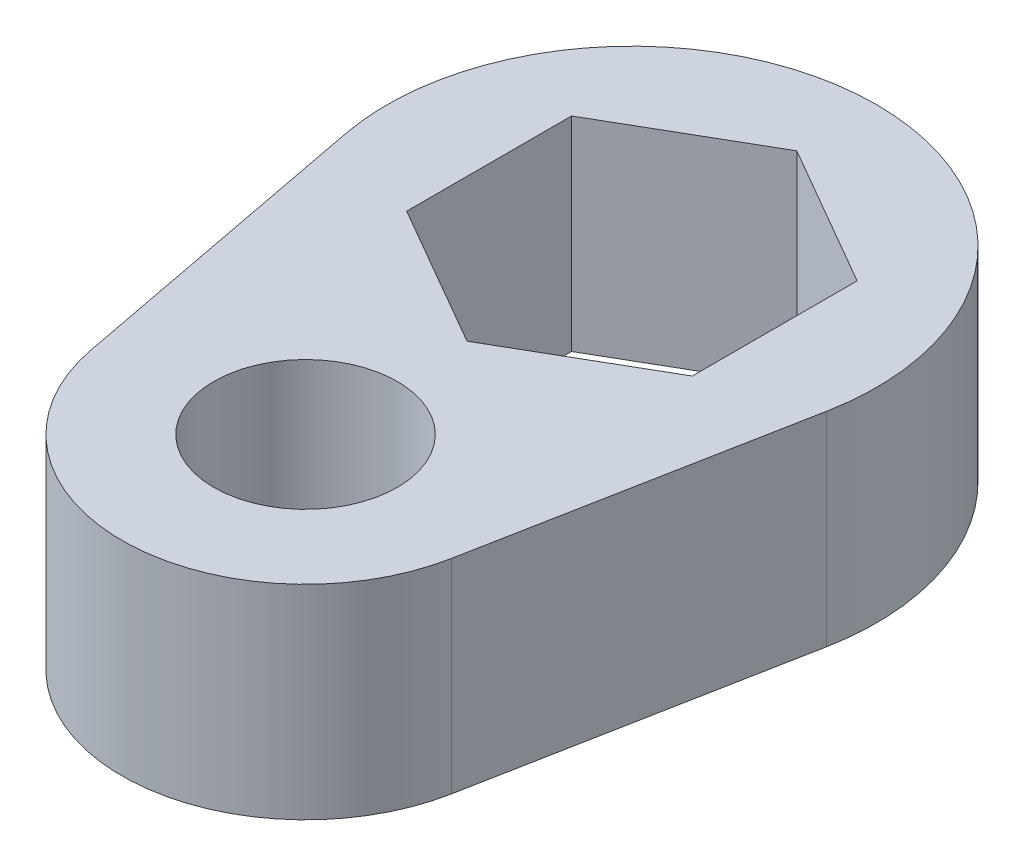
from build123d import *

# Parameters (mm, degrees)
SKETCH1_R           = 2.25
BOSS_EXTRUDE1_DEPTH = 5


with BuildPart() as part:
    # Sketch1 → Boss-Extrude1 (new body)
    with BuildSketch(Plane(origin=(0, 0, 0), x_dir=(1, 0, 0), z_dir=(0, 1, 0))):
        with BuildLine():
            Line((-5.893587617, -1.125), (-4.420190713, -8.84375))
            ThreePointArc((-4.420190713, -8.84375), (0, -12.5), (4.420190713, -8.84375))
            Line((4.420190713, -8.84375), (5.893587617, -1.125))
            ThreePointArc((5.893587617, -1.125), (0, 6), (-5.893587617, -1.125))
        make_face()
        with Locations(Location((0, -8, 0), (0, 0, 270))):
            Circle(SKETCH1_R, mode=Mode.SUBTRACT)
        Polygon((0, 4.041451884), (-3.5, 2.020725942), (-3.5, -2.020725942), (0, -4.041451884), (3.5, -2.020725942), (3.5, 2.020725942), align=None, mode=Mode.SUBTRACT)
    extrude(amount=BOSS_EXTRUDE1_DEPTH)


solid = part.part
